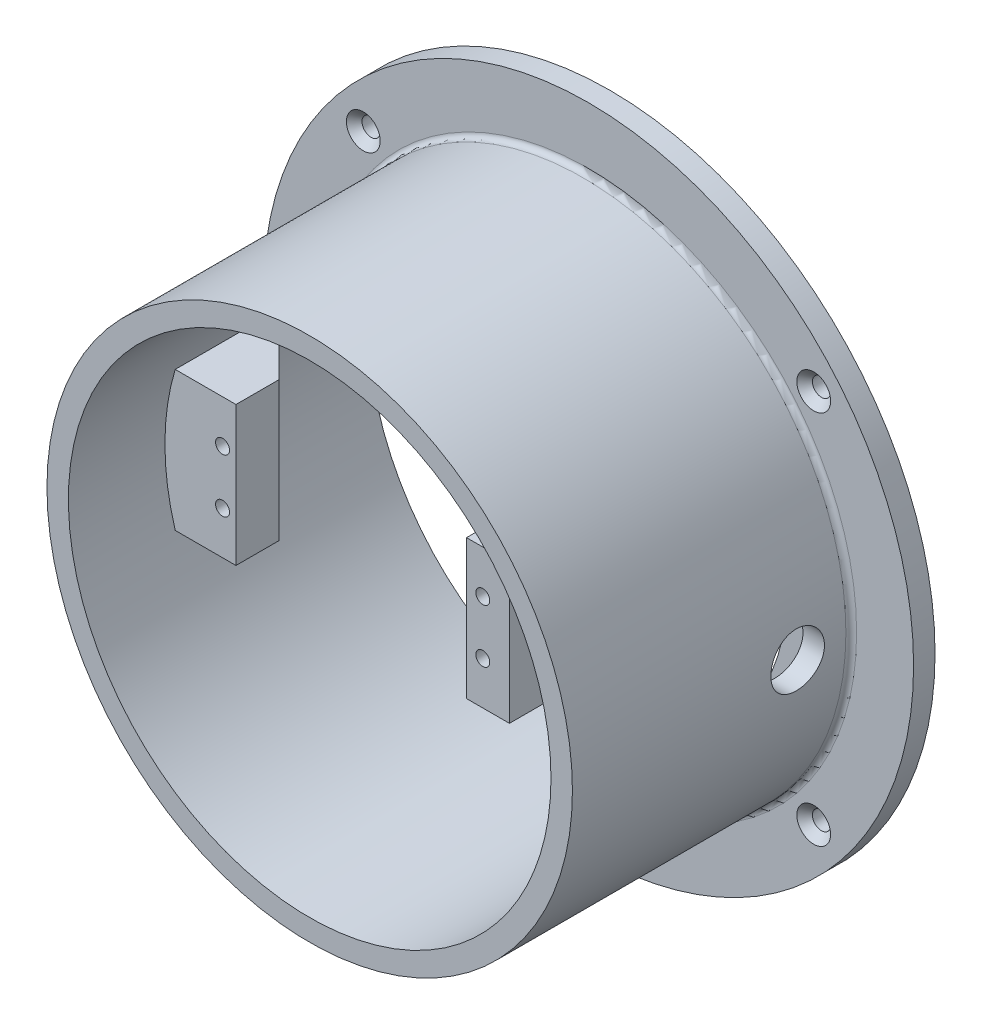
from build123d import *

# Parameters (mm, degrees)
SKETCH1_R                                           = 60.625
SKETCH1_R_2                                         = 45
BOSS_EXTRUDE1_DEPTH                                 = 4
SKETCH2_R                                           = 49
SKETCH2_R_2                                         = 45
BOSS_EXTRUDE2_DEPTH                                 = 52
SKETCH3_W                                           = 13.25
SKETCH3_H                                           = 8
SKETCH3_W_2                                         = 8
SKETCH3_H_2                                         = 38
BOSS_EXTRUDE3_DEPTH                                 = 13
SKETCH4_W                                           = 24
SKETCH4_H                                           = 10
CUT_EXTRUDE1_DEPTH                                  = 26
SKETCH5_R                                           = 5
CUT_EXTRUDE2_DEPTH                                  = 74
SKETCH6_R                                           = 1.3
CUT_EXTRUDE3_DEPTH                                  = 7.2
BOSS_EXTRUDE4_DEPTH                                 = 4
CSK_FOR_M3_COUNTERSUNK_FLAT_HEAD_SCREW1_D           = 3.4
CSK_FOR_M3_COUNTERSUNK_FLAT_HEAD_SCREW1_DEPTH       = 4
CSK_FOR_M3_COUNTERSUNK_FLAT_HEAD_SCREW1_CSINK_D     = 6.3
CSK_FOR_M3_COUNTERSUNK_FLAT_HEAD_SCREW1_CSINK_ANGLE = 90
CSK_FOR_M3_COUNTERSUNK_FLAT_HEAD_SCREW1_TIP         = 1.021463052
FILLET1_R                                           = 1


with BuildPart() as part:
    # Sketch1 → Boss-Extrude1 (new body)
    with BuildSketch(Plane.XY):
        Circle(SKETCH1_R)
        Circle(SKETCH1_R_2, mode=Mode.SUBTRACT)
    extrude(amount=BOSS_EXTRUDE1_DEPTH)

    # Sketch2 → Boss-Extrude2 (add)
    with BuildSketch(Plane.XY.offset(4)):
        with Locations(Location((0, 0, 0), (0, 0, 180))):
            Circle(SKETCH2_R)
        Circle(SKETCH2_R_2, mode=Mode.SUBTRACT)
    extrude(amount=BOSS_EXTRUDE2_DEPTH)

    # Sketch3 → Boss-Extrude3 (add, symmetric)
    with BuildSketch(Plane(origin=(0, 0, 0), x_dir=(1, 0, 0), z_dir=(0, 1, 0))):
        with Locations((-38.375, -34)):
            Rectangle(SKETCH3_W, SKETCH3_H)
        Polygon((-45, -16.75), (-45, -30), (-31.75, -30), align=None)
        with Locations((15.25, -19)):
            Rectangle(SKETCH3_W_2, SKETCH3_H_2)
    extrude(amount=BOSS_EXTRUDE3_DEPTH, both=True)


with BuildPart() as boss_extrude3_piece_1:
    # of the separate pieces the step leaves, piece 1, a body of its own (boss_extrude3_pieces)
    add(part.part.solids().sort_by_distance((60.625, 0, 0))[0])

    # Sketch5 → Cut-Extrude2 (cut)
    with BuildSketch(Plane.ZY.offset(-11.25)):
        with Locations((14, 0)):
            Circle(SKETCH5_R)
    extrude(amount=-CUT_EXTRUDE2_DEPTH, mode=Mode.SUBTRACT)


with BuildPart() as boss_extrude3_piece_2:
    # of the separate pieces the step leaves, piece 2, a body of its own (boss_extrude3_pieces)
    add(part.part.solids().sort_by_distance((19.25, -13, 0))[0])

    # Sketch4 → Cut-Extrude1 (cut)
    with BuildSketch(Plane.ZY.offset(-11.25)):
        with Locations((17, 0)):
            Rectangle(SKETCH4_W, SKETCH4_H)
    extrude(amount=-CUT_EXTRUDE1_DEPTH, mode=Mode.SUBTRACT)


with BuildPart() as cut_extrude3_tool:
    # Sketch6 → Cut-Extrude3 (new body)
    with BuildSketch(Plane.XY.offset(38)):
        with Locations((-34.25, 5)):
            Circle(SKETCH6_R)
        with Locations((-34.25, -5)):
            Circle(SKETCH6_R)
        with Locations((14.281113412, 5)):
            Circle(SKETCH6_R)
        with Locations((14.281113412, -5)):
            Circle(SKETCH6_R)
    extrude(amount=-CUT_EXTRUDE3_DEPTH)


with BuildPart() as boss_extrude3_piece_1_1:
    add(boss_extrude3_piece_1.part)

    # Cut-Extrude3: cut by cut_extrude3_tool
    add(cut_extrude3_tool.part, mode=Mode.SUBTRACT)



with BuildPart() as boss_extrude3_piece_2_1:
    add(boss_extrude3_piece_2.part)

    # Cut-Extrude3: cut by cut_extrude3_tool
    add(cut_extrude3_tool.part, mode=Mode.SUBTRACT)


with BuildPart() as boss_extrude3_piece_1_2:
    add(boss_extrude3_piece_1_1.part)

    add(boss_extrude3_piece_2_1.part)  # Boss-Extrude4 merges Boss-Extrude3 piece 2
    # Sketch8 → Boss-Extrude4 (add)
    with BuildSketch(Plane(origin=(0, 0, 0), x_dir=(-1, 0, 0), z_dir=(0, 0, -1))):
        with BuildLine():
            Line((-11.25, 13), (-11.25, -13))
            Line((-11.25, -13), (-25.249838503, -37.248431585))
            ThreePointArc((-25.249838503, -37.248431585), (-45, 0), (-25.249838503, 37.248431585))
            Line((-25.249838503, 37.248431585), (-11.25, 13))
        make_face()
        with BuildLine():
            Line((-24.25, -19.516660498), (-27.361802413, -24.906460381))
            ThreePointArc((-27.361802413, -24.906460381), (-37, 0), (-27.361802413, 24.906460381))
            Line((-27.361802413, 24.906460381), (-24.25, 19.516660498))
            Line((-24.25, 19.516660498), (-24.25, -19.516660498))
        make_face(mode=Mode.SUBTRACT)
    extrude(amount=-BOSS_EXTRUDE4_DEPTH)

    # CSK for M3 Countersunk Flat Head Screw1
    with Locations(Plane.XY.offset(4)):
        with Locations((-42, -35), (42, -35), (42, 35), (-42, 35)):
            CounterSinkHole(CSK_FOR_M3_COUNTERSUNK_FLAT_HEAD_SCREW1_D / 2, CSK_FOR_M3_COUNTERSUNK_FLAT_HEAD_SCREW1_CSINK_D / 2, depth=CSK_FOR_M3_COUNTERSUNK_FLAT_HEAD_SCREW1_DEPTH, counter_sink_angle=CSK_FOR_M3_COUNTERSUNK_FLAT_HEAD_SCREW1_CSINK_ANGLE)
            with Locations((0, 0, -(CSK_FOR_M3_COUNTERSUNK_FLAT_HEAD_SCREW1_DEPTH + CSK_FOR_M3_COUNTERSUNK_FLAT_HEAD_SCREW1_TIP / 2))):  # 118° drill point
                Cone(0, CSK_FOR_M3_COUNTERSUNK_FLAT_HEAD_SCREW1_D / 2, CSK_FOR_M3_COUNTERSUNK_FLAT_HEAD_SCREW1_TIP, mode=Mode.SUBTRACT)

    # Fillet1
    fillet1_edges = [boss_extrude3_piece_1_2.edges().sort_by_distance(p)[0] for p in [
        (49, 0, 4),
    ]]
    fillet(fillet1_edges, radius=FILLET1_R)


solid = boss_extrude3_piece_1_2.part
